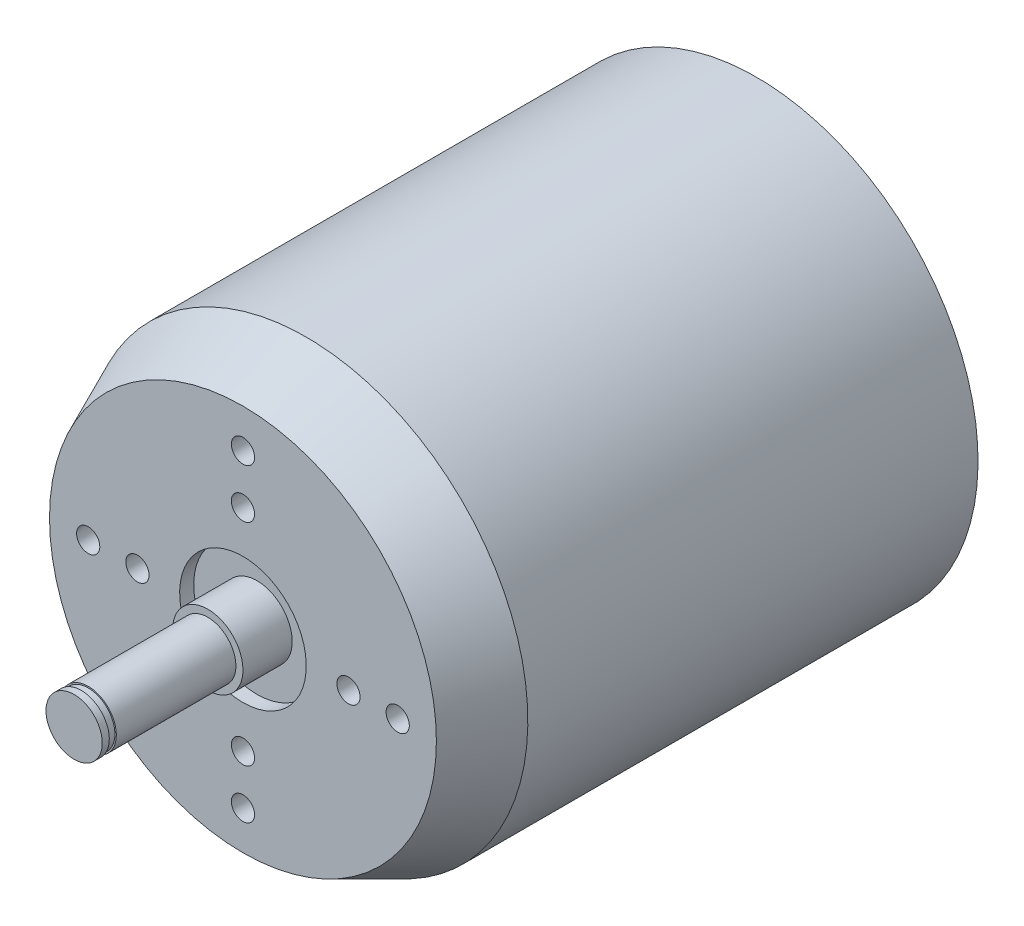
from build123d import *

# Parameters (mm, degrees)
TAP_DRILL_FOR_M4X0_7_TAP1_D     = 3.3
TAP_DRILL_FOR_M4X0_7_TAP1_DEPTH = 5
TAP_DRILL_FOR_M4X0_7_TAP1_TIP   = 0.991420021


with BuildPart() as part:
    # Sketch2 → Revolve1 (revolve)
    with BuildSketch(Plane(origin=(0, 0, 0), x_dir=(0, 0, -1), z_dir=(1, 0, 0)), mode=Mode.PRIVATE) as revolve1_sk:
        Polygon((2, 0), (2, 5), (-5, 5), (-5, 4), (-22, 4), (-22, 3.8), (-23, 3.8), (-23, 4), (-24, 4), (-24, 0), align=None)
        Polygon((2, 9), (2, 0), (74, 0), (74, 15), (73, 15), (73, 31.5), (9, 31.5), (0, 27.5), (0, 9), align=None)
    revolve(revolve1_sk.sketch.rotate(Axis((0, 0, -2), (0, 0, -1)), 180), axis=Axis((0, 0, -2), (0, 0, -1)))

    # Tap Drill for M4x0.7 Tap1
    with Locations(Plane(origin=(0, 22, 0), x_dir=(1, 0, 0), z_dir=(0, 0, 1))):
        with Locations((0, 0), (0, -7), (15, -22), (22, -22), (0, -37), (0, -44), (-15, -22), (-22, -22)):
            Hole(TAP_DRILL_FOR_M4X0_7_TAP1_D / 2, depth=TAP_DRILL_FOR_M4X0_7_TAP1_DEPTH)
            with Locations((0, 0, -(TAP_DRILL_FOR_M4X0_7_TAP1_DEPTH + TAP_DRILL_FOR_M4X0_7_TAP1_TIP / 2))):  # 118° drill point
                Cone(0, TAP_DRILL_FOR_M4X0_7_TAP1_D / 2, TAP_DRILL_FOR_M4X0_7_TAP1_TIP, mode=Mode.SUBTRACT)


solid = part.part
